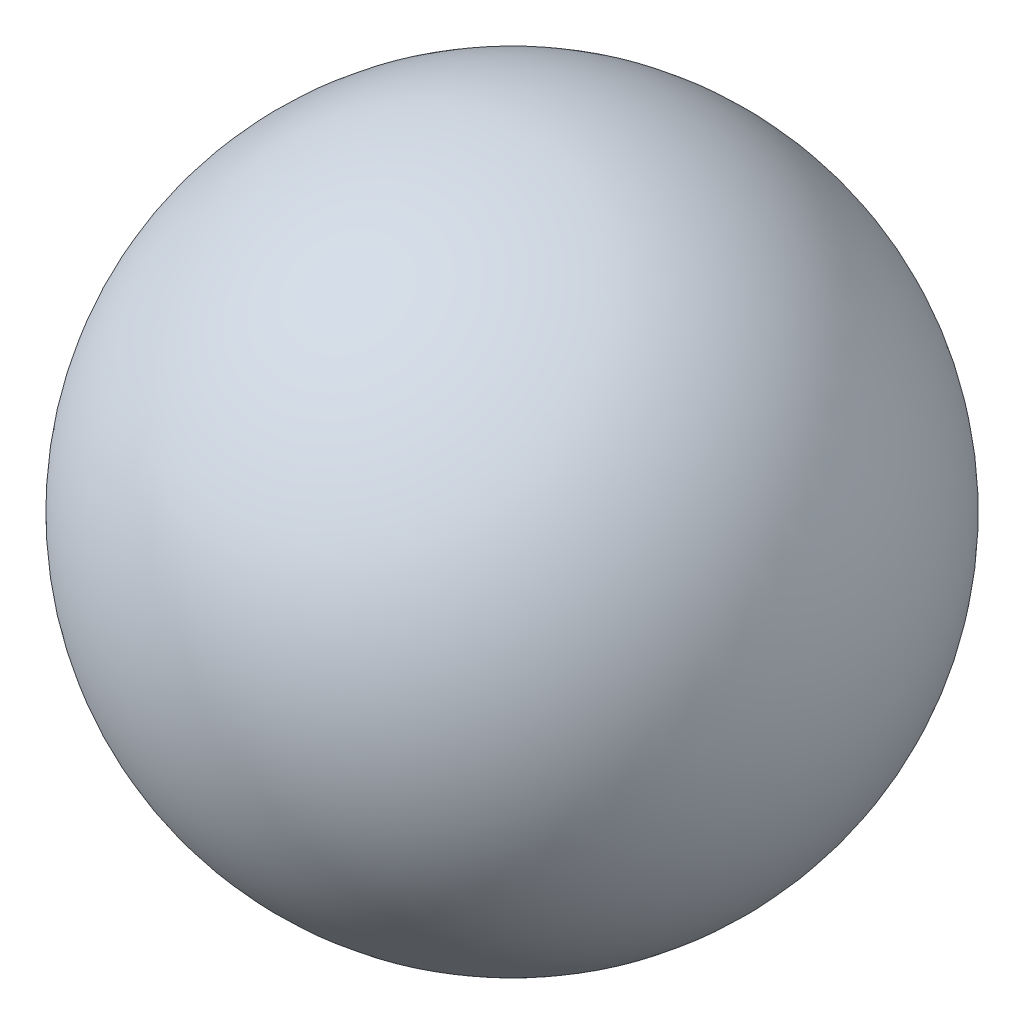
from build123d import *


with BuildPart() as part:
    # Sketch2 → Revolve4 (revolve)
    with BuildSketch(Plane.XY):
        with BuildLine():
            Line((0, 12), (0, -12))
            ThreePointArc((0, -12), (-12, 0), (0, 12))
        make_face()
    revolve(axis=Axis((0, 12, 0), (0, -1, 0)))


solid = part.part
